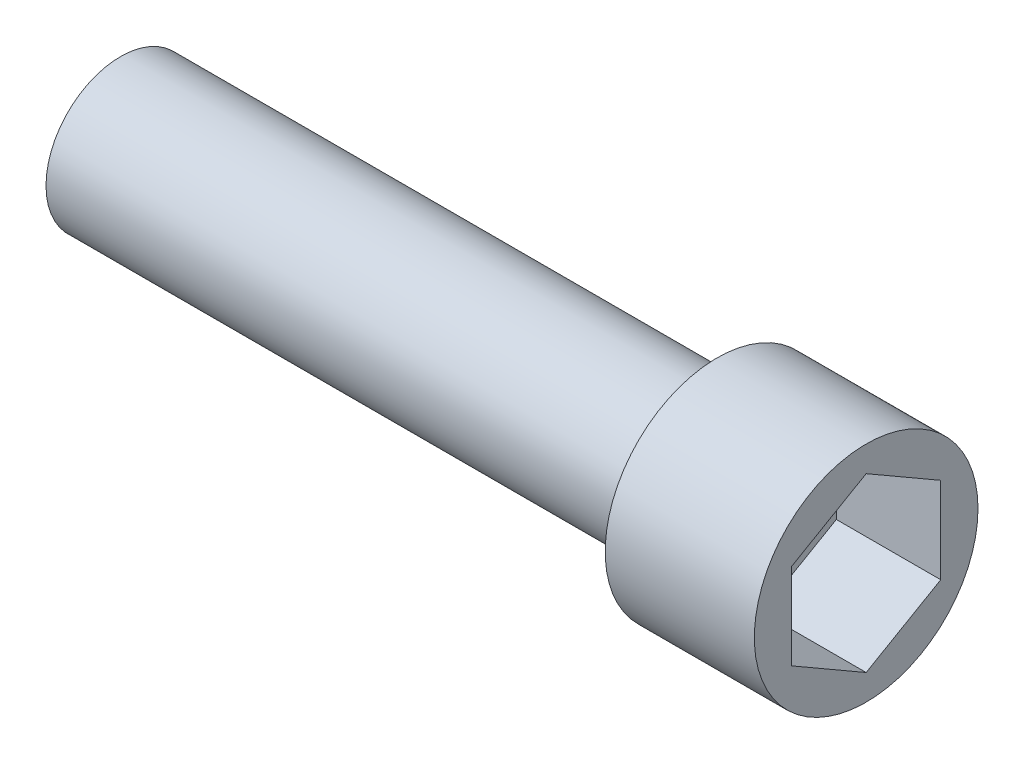
from build123d import *

# Parameters (mm, degrees)
SKETCH1_R           = 7.5
BOSS_EXTRUDE1_DEPTH = 10
CUT_EXTRUDE1_DEPTH  = 7
SKETCH3_R           = 5
BOSS_EXTRUDE2_DEPTH = 40


with BuildPart() as part:
    # Sketch1 → Boss-Extrude1 (new body)
    with BuildSketch(Plane.YZ):
        with Locations(Location((0, 0, 0), (0, 0, 270))):
            Circle(SKETCH1_R)
    extrude(amount=BOSS_EXTRUDE1_DEPTH)

    # Sketch2 → Cut-Extrude1 (cut)
    with BuildSketch(Plane.YZ.offset(10)):
        Polygon((2.886751346, -5), (5.773502692, 0), (2.886751346, 5), (-2.886751346, 5), (-5.773502692, 0), (-2.886751346, -5), align=None)
    extrude(amount=-CUT_EXTRUDE1_DEPTH, mode=Mode.SUBTRACT)

    # Sketch3 → Boss-Extrude2 (add)
    with BuildSketch(Plane(origin=(0, 0, 0), x_dir=(0, -1, 0), z_dir=(-1, 0, 0))):
        with Locations(Location((0, 0, 0), (0, 0, 90))):
            Circle(SKETCH3_R)
    extrude(amount=BOSS_EXTRUDE2_DEPTH)


solid = part.part
